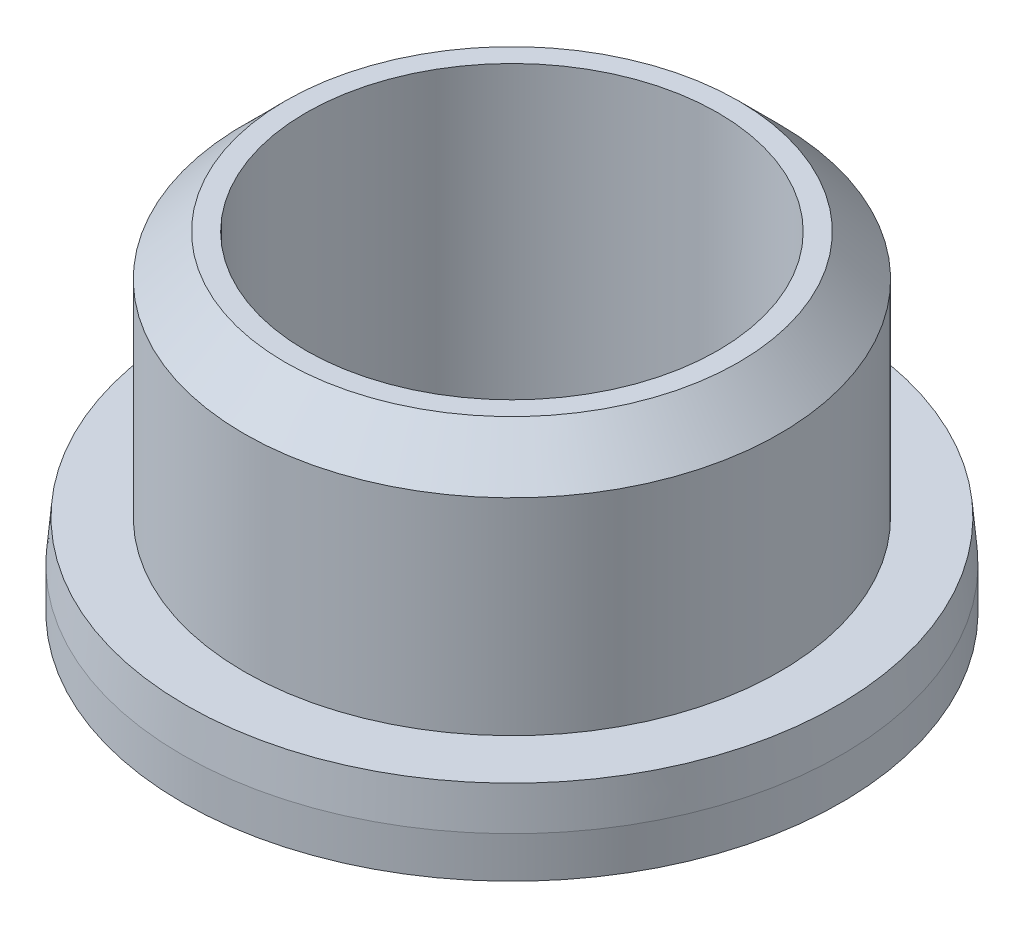
from build123d import *

# Parameters (mm, degrees)
SKETCH1_R           = 8
BOSS_EXTRUDE1_DEPTH = 2
SKETCH2_R           = 6.5
BOSS_EXTRUDE2_DEPTH = 6
SKETCH3_R           = 5
CUT_EXTRUDE1_DEPTH  = 8
CHAMFER1_SIZE       = 1
CHAMFER2_SIZE       = 1
CHAMFER2_SIZE2      = 0.087488664


with BuildPart() as part:
    # Sketch1 → Boss-Extrude1 (new body)
    with BuildSketch(Plane(origin=(0, 0, 0), x_dir=(1, 0, 0), z_dir=(0, 1, 0))):
        with Locations(Location((0, 0, 0), (0, 0, 270))):
            Circle(SKETCH1_R)
    extrude(amount=BOSS_EXTRUDE1_DEPTH)

    # Sketch2 → Boss-Extrude2 (add)
    with BuildSketch(Plane(origin=(0, 2, 0), x_dir=(1, 0, 0), z_dir=(0, 1, 0))):
        with Locations(Location((0, 0, 0), (0, 0, 270))):
            Circle(SKETCH2_R)
    extrude(amount=BOSS_EXTRUDE2_DEPTH)

    # Sketch3 → Cut-Extrude1 (cut)
    with BuildSketch(Plane(origin=(0, 8, 0), x_dir=(1, 0, 0), z_dir=(0, 1, 0))):
        with Locations(Location((0, 0, 0), (0, 0, 270))):
            Circle(SKETCH3_R)
    extrude(amount=-CUT_EXTRUDE1_DEPTH, mode=Mode.SUBTRACT)

    # Chamfer1
    chamfer1_edges = [part.edges().sort_by_distance(p)[0] for p in [
        (0, 8, -6.5),
    ]]
    chamfer(chamfer1_edges, length=CHAMFER1_SIZE)

    # Chamfer2
    chamfer2_edges = [part.edges().sort_by_distance(p)[0] for p in [
        (0, 2, -8),
    ]]
    chamfer2_side = [part.faces().sort_by_distance(p)[0] for p in [
        (0, 1, -8),
    ]]
    chamfer(chamfer2_edges, length=CHAMFER2_SIZE, length2=CHAMFER2_SIZE2, reference=chamfer2_side[0])


solid = part.part
